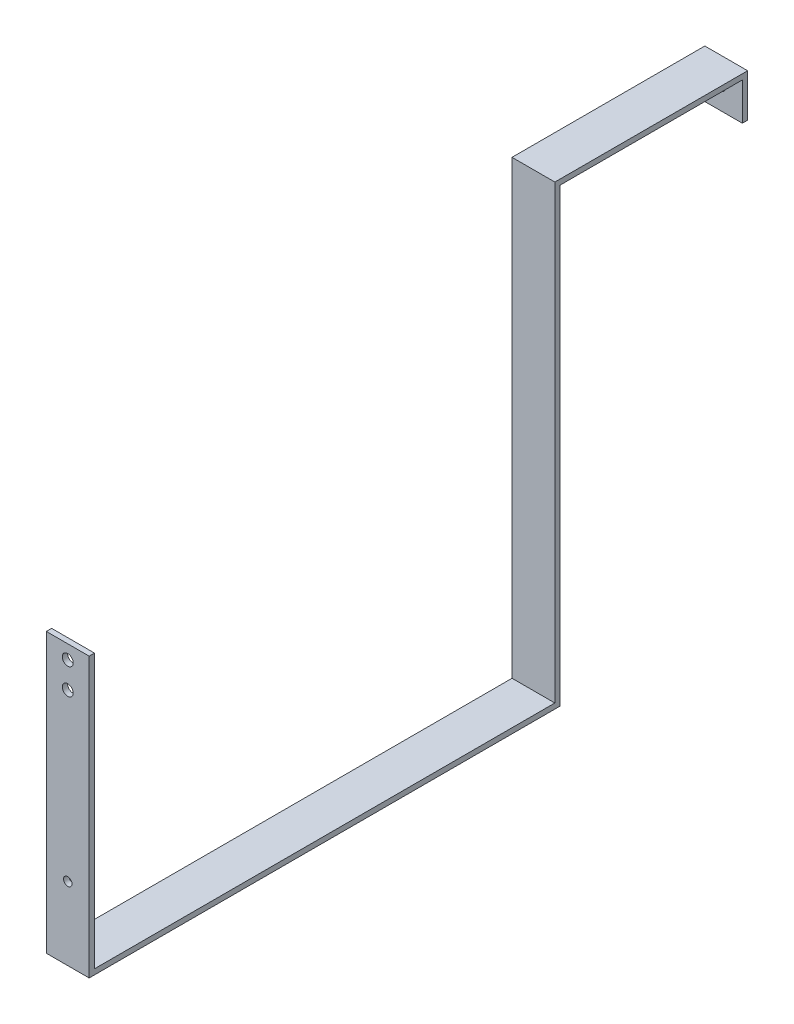
from build123d import *

# Parameters (mm, degrees)
CROQUIS1_W              = 50.8
CROQUIS1_H              = 6.31
SALIENTE_EXTRUIR1_DEPTH = 228.75
CROQUIS2_W              = 50.8
CROQUIS2_H              = 6.31
SALIENTE_EXTRUIR2_DEPTH = 535.27
CROQUIS3_W              = 50.8
CROQUIS3_H              = 6.31
SALIENTE_EXTRUIR3_DEPTH = 552.5
CROQUIS4_W              = 50.8
CROQUIS4_H              = 6.31
SALIENTE_EXTRUIR4_DEPTH = 324.39
CROQUIS5_W              = 50.8
CROQUIS5_H              = 6.31
SALIENTE_EXTRUIR5_DEPTH = 50.8
CROQUIS7_R              = 5
CORTAR_EXTRUIR2_DEPTH   = 415.8
CROQUIS8_R              = 6.5
CORTAR_EXTRUIR3_DEPTH   = 10
CROQUIS9_R              = 5
CORTAR_EXTRUIR4_DEPTH   = 35


with BuildPart() as part:
    # Croquis1 → Saliente-Extruir1 (new body)
    with BuildSketch(Plane.XY):
        Rectangle(CROQUIS1_W, CROQUIS1_H)
    extrude(amount=SALIENTE_EXTRUIR1_DEPTH)

    # Croquis2 → Saliente-Extruir2 (add)
    with BuildSketch(Plane.XZ.offset(3.155)):
        with Locations((0, 225.595)):
            Rectangle(CROQUIS2_W, CROQUIS2_H)
    extrude(amount=SALIENTE_EXTRUIR2_DEPTH)

    # Croquis3 → Saliente-Extruir3 (add)
    with BuildSketch(Plane.XY.offset(228.75)):
        with Locations((0, -535.27)):
            Rectangle(CROQUIS3_W, CROQUIS3_H)
    extrude(amount=SALIENTE_EXTRUIR3_DEPTH)

    # Croquis4 → Saliente-Extruir4 (add)
    with BuildSketch(Plane(origin=(0, -532.115, 0), x_dir=(1, 0, 0), z_dir=(0, 1, 0))):
        with Locations((0, -778.095)):
            Rectangle(CROQUIS4_W, CROQUIS4_H)
    extrude(amount=SALIENTE_EXTRUIR4_DEPTH)

    # Croquis5 → Saliente-Extruir5 (add)
    with BuildSketch(Plane(origin=(0, 3.155, 0), x_dir=(1, 0, 0), z_dir=(0, 1, 0))):
        with Locations((0, -3.155)):
            Rectangle(CROQUIS5_W, CROQUIS5_H)
    extrude(amount=-SALIENTE_EXTRUIR5_DEPTH)

    # Croquis7 → Cortar-Extruir2 (cut)
    with BuildSketch(Plane.XY.offset(6.31)):
        with Locations((0, -22.245)):
            Circle(CROQUIS7_R)
    extrude(amount=-CORTAR_EXTRUIR2_DEPTH, mode=Mode.SUBTRACT)

    # Croquis8 → Cortar-Extruir3 (cut)
    with BuildSketch(Plane.XY.offset(781.25)):
        with Locations((0, -224.225)):
            Circle(CROQUIS8_R)
        with Locations((0, -255.225)):
            Circle(CROQUIS8_R)
    extrude(amount=-CORTAR_EXTRUIR3_DEPTH, mode=Mode.SUBTRACT)

    # Croquis9 → Cortar-Extruir4 (cut)
    with BuildSketch(Plane.XY.offset(781.25)):
        with Locations((0, -451.925)):
            Circle(CROQUIS9_R)
    extrude(amount=-CORTAR_EXTRUIR4_DEPTH, mode=Mode.SUBTRACT)


solid = part.part
